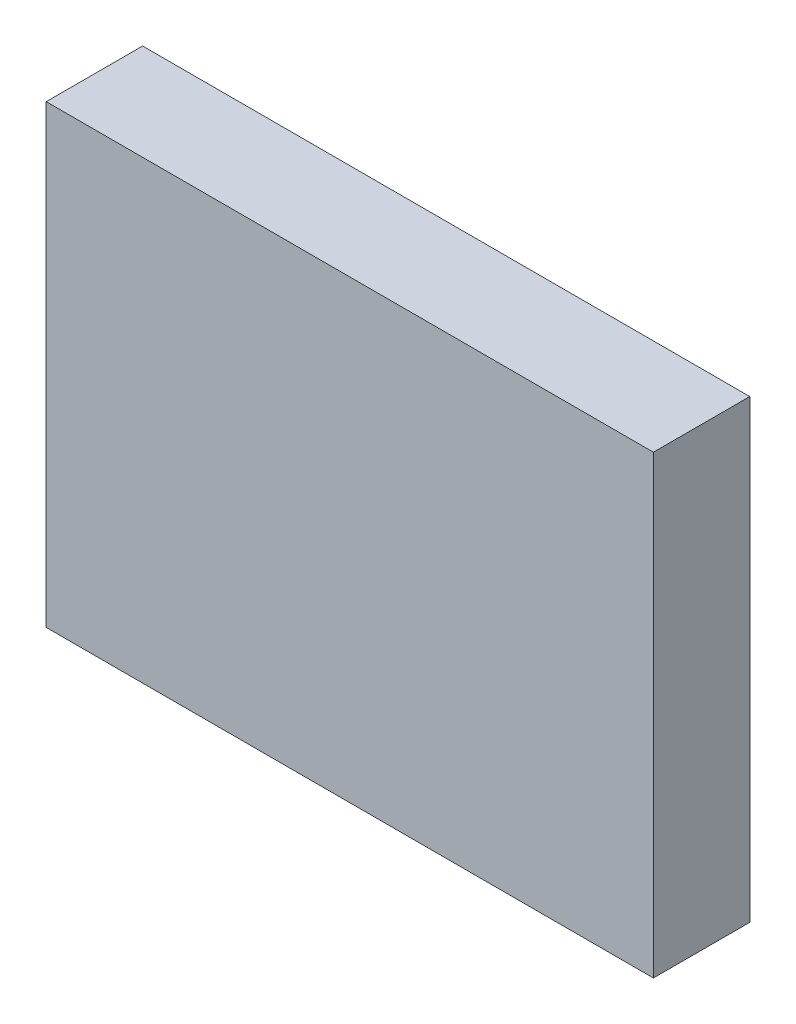
from build123d import *

# Parameters (mm, degrees)
SKETCH1_W           = 160
SKETCH1_H           = 120
BOSS_EXTRUDE1_DEPTH = 25.4


with BuildPart() as part:
    # Sketch1 → Boss-Extrude1 (new body)
    with BuildSketch(Plane.XY):
        Rectangle(SKETCH1_W, SKETCH1_H)
    extrude(amount=BOSS_EXTRUDE1_DEPTH)


solid = part.part
